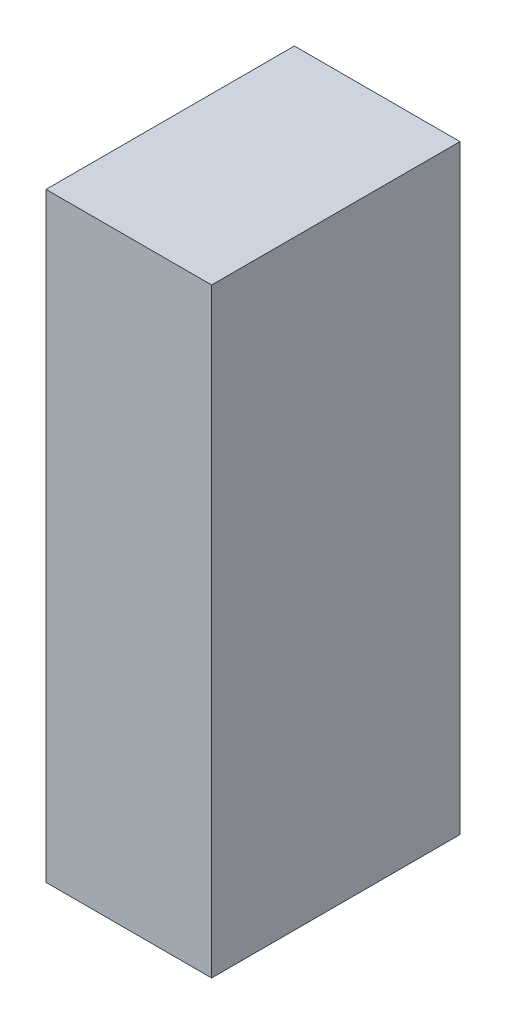
from build123d import *

# Parameters (mm, degrees)
ESQUISSE1_W        = 8
ESQUISSE1_H        = 12
BOSS_EXTRU_1_DEPTH = 29


with BuildPart() as part:
    # Esquisse1 → Boss.-Extru.1 (new body)
    with BuildSketch(Plane(origin=(0, 0, 0), x_dir=(1, 0, 0), z_dir=(0, 1, 0))):
        Rectangle(ESQUISSE1_W, ESQUISSE1_H)
    extrude(amount=BOSS_EXTRU_1_DEPTH)


solid = part.part
